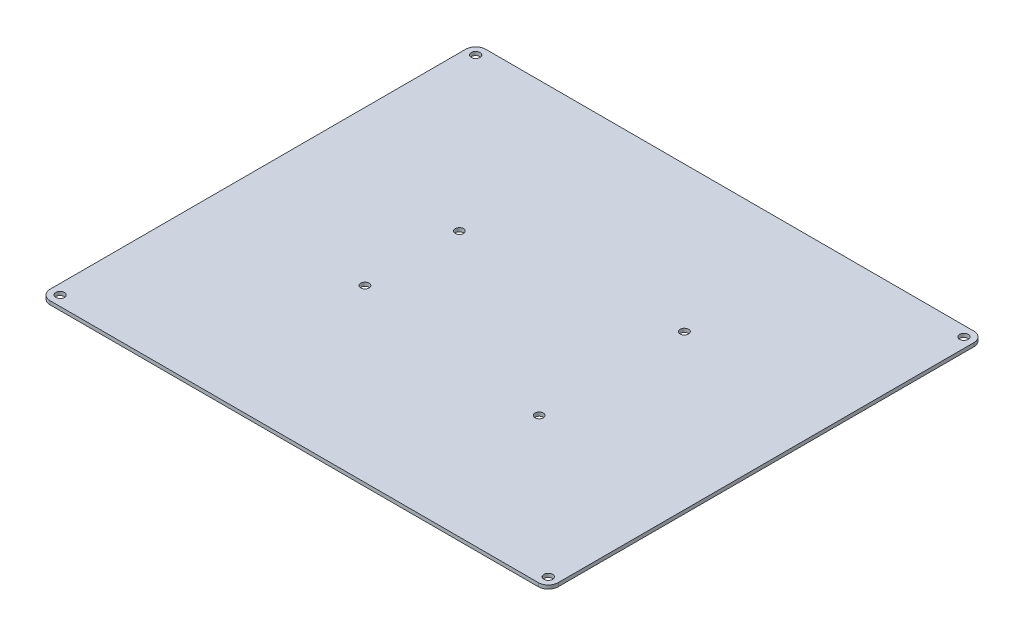
from build123d import *

# Parameters (mm, degrees)
SKETCH1_W           = 140
SKETCH1_H           = 120
SKETCH1_R           = 1.2
SKETCH1_R_2         = 1.15
BOSS_EXTRUDE1_DEPTH = 1
FILLET1_R           = 2.75


with BuildPart() as part:
    # Sketch1 → Boss-Extrude1 (new body)
    with BuildSketch(Plane(origin=(0, 0, 0), x_dir=(1, 0, 0), z_dir=(0, 1, 0))):
        with Locations((70, -60)):
            Rectangle(SKETCH1_W, SKETCH1_H)
        with Locations(Location((2.75, -2.75, 0), (0, 0, 270))):
            Circle(SKETCH1_R, mode=Mode.SUBTRACT)
        with Locations(Location((137.25, -2.75, 0), (0, 0, 90))):
            Circle(SKETCH1_R, mode=Mode.SUBTRACT)
        with Locations(Location((137.25, -117.25, 0), (0, 0, 270))):
            Circle(SKETCH1_R, mode=Mode.SUBTRACT)
        with Locations(Location((2.75, -117.25, 0), (0, 0, 90))):
            Circle(SKETCH1_R, mode=Mode.SUBTRACT)
        with Locations(Location((42.5, -47, 0), (0, 0, 270))):
            Circle(SKETCH1_R_2, mode=Mode.SUBTRACT)
        with Locations(Location((97.5, -40, 0), (0, 0, 270))):
            Circle(SKETCH1_R_2, mode=Mode.SUBTRACT)
        with Locations(Location((42.5, -73, 0), (0, 0, 270))):
            Circle(SKETCH1_R_2, mode=Mode.SUBTRACT)
        with Locations(Location((97.5, -80, 0), (0, 0, 270))):
            Circle(SKETCH1_R_2, mode=Mode.SUBTRACT)
    extrude(amount=BOSS_EXTRUDE1_DEPTH)

    # Fillet1
    fillet1_edges = [part.edges().sort_by_distance(p)[0] for p in [
        (0, 0.5, 0),
        (140, 0.5, 0),
        (140, 0.5, 120),
        (0, 0.5, 120),
    ]]
    fillet(fillet1_edges, radius=FILLET1_R)


solid = part.part
